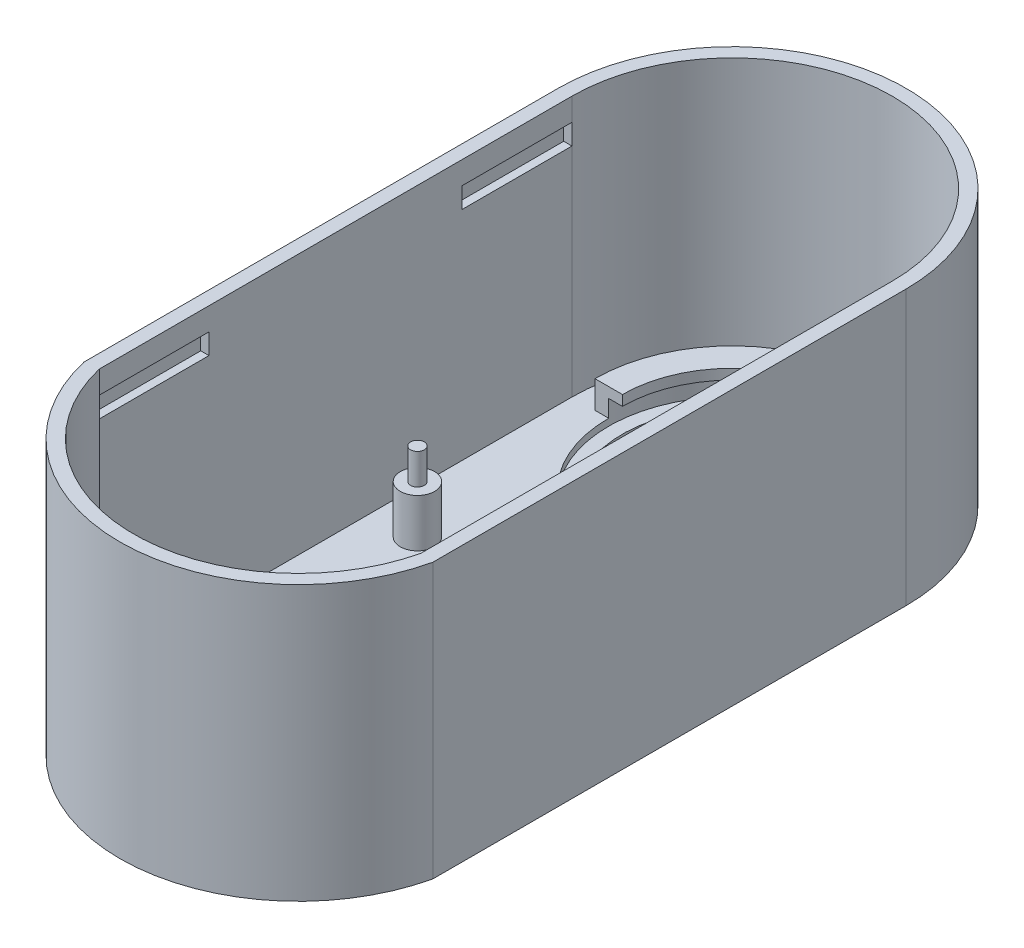
from build123d import *

# Parameters (mm, degrees)
SALIENTE_EXTRUIR5_DEPTH  = 40
CORTAR_EXTRUIR3_DEPTH    = 38
CROQUIS19_R              = 16
CORTAR_EXTRUIR4_DEPTH    = 16
CROQUIS22_R              = 6
CORTAR_EXTRUIR6_DEPTH    = 16
CROQUIS25_W              = 6
CROQUIS25_H              = 16
CORTAR_EXTRUIR10_DEPTH   = 0.6
CROQUIS28_R              = 18
CORTAR_EXTRUIR11_DEPTH   = 1
SALIENTE_EXTRUIR7_DEPTH  = 4
CROQUIS30_R              = 16
CORTAR_EXTRUIR12_DEPTH   = 34
CORTAR_EXTRUIR13_START   = 3.5
CROQUIS31_R              = 18
CORTAR_EXTRUIR13_DEPTH   = 3.5
CROQUIS24_W              = 16
CROQUIS24_H              = 3
CORTAR_EXTRUIR14_DEPTH   = 1.2
CROQUIS23_W              = 16
CROQUIS23_H              = 3
CORTAR_EXTRUIR15_DEPTH   = 1.2
CROQUIS32_R              = 2.5
SALIENTE_EXTRUIR8_DEPTH  = 7
CROQUIS49_R              = 1
SALIENTE_EXTRUIR9_DEPTH  = 4.5
CROQUIS47_R              = 1
SALIENTE_EXTRUIR10_DEPTH = 4.5
CROQUIS48_R              = 1
SALIENTE_EXTRUIR11_DEPTH = 4.5
CROQUIS50_R              = 1
SALIENTE_EXTRUIR12_DEPTH = 4.5


with BuildPart() as part:
    # Croquis1 → Saliente-Extruir5 (new body)
    with BuildSketch(Plane(origin=(0, 0, 0), x_dir=(1, 0, 0), z_dir=(0, 1, 0))):
        with BuildLine():
            Line((-76.52774776, -47.188914739), (-76.52774776, 21.977990865))
            ThreePointArc((-76.52774776, 21.977990865), (-51.168030611, 47.337708015), (-25.808313462, 21.977990865))
            Line((-25.808313462, 21.977990865), (-25.808313462, -47.033075243))
            ThreePointArc((-25.808313462, -47.033075243), (-51.106035712, -67.287819919), (-76.52774776, -47.188914739))
        make_face()
    extrude(amount=SALIENTE_EXTRUIR5_DEPTH)

    # Croquis16 → Cortar-Extruir3 (cut)
    with BuildSketch(Plane(origin=(0, 40, 0), x_dir=(1, 0, 0), z_dir=(0, 1, 0))):
        with BuildLine():
            Line((-74.52774776, 21.977990865), (-74.52774776, -46.95348914))
            ThreePointArc((-74.52774776, -46.95348914), (-51.109128236, -65.287819786), (-27.808313462, -46.804003852))
            Line((-27.808313462, -46.804003852), (-27.808313462, 21.977990865))
            ThreePointArc((-27.808313462, 21.977990865), (-51.168030611, 45.337708015), (-74.52774776, 21.977990865))
        make_face()
    extrude(amount=-CORTAR_EXTRUIR3_DEPTH, mode=Mode.SUBTRACT)

    # Croquis19 → Cortar-Extruir4 (cut)
    with BuildSketch(Plane(origin=(0, 2, 0), x_dir=(1, 0, 0), z_dir=(0, 1, 0))):
        with Locations(Location((-51.168030611, 21.977990865, 0), (0, 0, 270))):
            Circle(CROQUIS19_R)
    extrude(amount=-CORTAR_EXTRUIR4_DEPTH, mode=Mode.SUBTRACT)

    # Croquis22 → Cortar-Extruir6 (cut)
    with BuildSketch(Plane(origin=(0, 2, 0), x_dir=(1, 0, 0), z_dir=(0, 1, 0))):
        with Locations(Location((-51.168030611, -14.810665764, 0), (0, 0, 270))):
            Circle(CROQUIS22_R)
    extrude(amount=-CORTAR_EXTRUIR6_DEPTH, mode=Mode.SUBTRACT)

    # Croquis25 → Cortar-Extruir10 (cut)
    with BuildSketch(Plane(origin=(0, 2, 0), x_dir=(1, 0, 0), z_dir=(0, 1, 0))):
        with Locations((-51.168030611, -14.810665764)):
            Rectangle(CROQUIS25_W, CROQUIS25_H)
    extrude(amount=-CORTAR_EXTRUIR10_DEPTH, mode=Mode.SUBTRACT)

    # Croquis28 → Cortar-Extruir11 (cut)
    with BuildSketch(Plane(origin=(0, 2, 0), x_dir=(1, 0, 0), z_dir=(0, 1, 0))):
        with Locations(Location((-51.168030611, 21.977990865, 0), (0, 0, 270))):
            Circle(CROQUIS28_R)
    extrude(amount=-CORTAR_EXTRUIR11_DEPTH, mode=Mode.SUBTRACT)

    # Croquis29 → Saliente-Extruir7 (add)
    with BuildSketch(Plane(origin=(0, 2, 0), x_dir=(1, 0, 0), z_dir=(0, 1, 0))):
        with BuildLine():
            Line((-71.168030611, 21.977990865), (-31.168030611, 21.977990865))
            ThreePointArc((-31.168030611, 21.977990865), (-51.168030611, 41.977990865), (-71.168030611, 21.977990865))
        make_face()
    extrude(amount=SALIENTE_EXTRUIR7_DEPTH)

    # Croquis30 → Cortar-Extruir12 (cut)
    with BuildSketch(Plane(origin=(0, 6, 0), x_dir=(1, 0, 0), z_dir=(0, 1, 0))):
        with Locations(Location((-51.168030611, 21.977990865, 0), (0, 0, 270))):
            Circle(CROQUIS30_R)
    extrude(amount=-CORTAR_EXTRUIR12_DEPTH, mode=Mode.SUBTRACT)

    # Croquis31 → Cortar-Extruir13 (cut)
    with BuildSketch(Plane(origin=(0, 1, 0), x_dir=(1, 0, 0), z_dir=(0, 1, 0)).offset(CORTAR_EXTRUIR13_START)):
        with Locations(Location((-51.168030611, 21.977990865, 0), (0, 0, 270))):
            Circle(CROQUIS31_R)
    extrude(amount=-CORTAR_EXTRUIR13_DEPTH, mode=Mode.SUBTRACT)

    # Croquis24 → Cortar-Extruir14 (cut)
    with BuildSketch(Plane.ZY.offset(27.808313462)):
        with Locations((-13.977990865, 35.2)):
            Rectangle(CROQUIS24_W, CROQUIS24_H)
        with Locations((38.804003852, 35.2)):
            Rectangle(CROQUIS24_W, CROQUIS24_H)
    extrude(amount=-CORTAR_EXTRUIR14_DEPTH, mode=Mode.SUBTRACT)

    # Croquis23 → Cortar-Extruir15 (cut)
    with BuildSketch(Plane(origin=(-74.52774776, 0, 0), x_dir=(0, 0, -1), z_dir=(1, 0, 0))):
        with Locations((-38.95348914, 35.2)):
            Rectangle(CROQUIS23_W, CROQUIS23_H)
        with Locations((13.977990865, 35.2)):
            Rectangle(CROQUIS23_W, CROQUIS23_H)
    extrude(amount=-CORTAR_EXTRUIR15_DEPTH, mode=Mode.SUBTRACT)

    # Croquis32 → Saliente-Extruir8 (add)
    with BuildSketch(Plane(origin=(0, 2, 0), x_dir=(1, 0, 0), z_dir=(0, 1, 0))):
        with Locations(Location((-68.12774776, -49.95348914, 0), (0, 0, 270))):
            Circle(CROQUIS32_R)
        with Locations(Location((-34.208313462, -49.804003852, 0), (0, 0, 270))):
            Circle(CROQUIS32_R)
        with Locations(Location((-68.12774776, -6.95348914, 0), (0, 0, 270))):
            Circle(CROQUIS32_R)
        with Locations(Location((-34.208313462, -6.804003852, 0), (0, 0, 270))):
            Circle(CROQUIS32_R)
    extrude(amount=SALIENTE_EXTRUIR8_DEPTH)

    # Croquis49 → Saliente-Extruir9 (add)
    with BuildSketch(Plane(origin=(0, 9, 0), x_dir=(1, 0, 0), z_dir=(0, 1, 0))):
        with Locations(Location((-34.208313462, -49.804003852, 0), (0, 0, 270))):
            Circle(CROQUIS49_R)
    extrude(amount=SALIENTE_EXTRUIR9_DEPTH)

    # Croquis47 → Saliente-Extruir10 (add)
    with BuildSketch(Plane(origin=(0, 9, 0), x_dir=(1, 0, 0), z_dir=(0, 1, 0))):
        with Locations(Location((-34.208313462, -6.804003852, 0), (0, 0, 270))):
            Circle(CROQUIS47_R)
    extrude(amount=SALIENTE_EXTRUIR10_DEPTH)

    # Croquis48 → Saliente-Extruir11 (add)
    with BuildSketch(Plane(origin=(0, 9, 0), x_dir=(1, 0, 0), z_dir=(0, 1, 0))):
        with Locations(Location((-68.12774776, -6.95348914, 0), (0, 0, 270))):
            Circle(CROQUIS48_R)
    extrude(amount=SALIENTE_EXTRUIR11_DEPTH)

    # Croquis50 → Saliente-Extruir12 (add)
    with BuildSketch(Plane(origin=(0, 9, 0), x_dir=(1, 0, 0), z_dir=(0, 1, 0))):
        with Locations(Location((-68.12774776, -49.95348914, 0), (0, 0, 270))):
            Circle(CROQUIS50_R)
    extrude(amount=SALIENTE_EXTRUIR12_DEPTH)


solid = part.part
